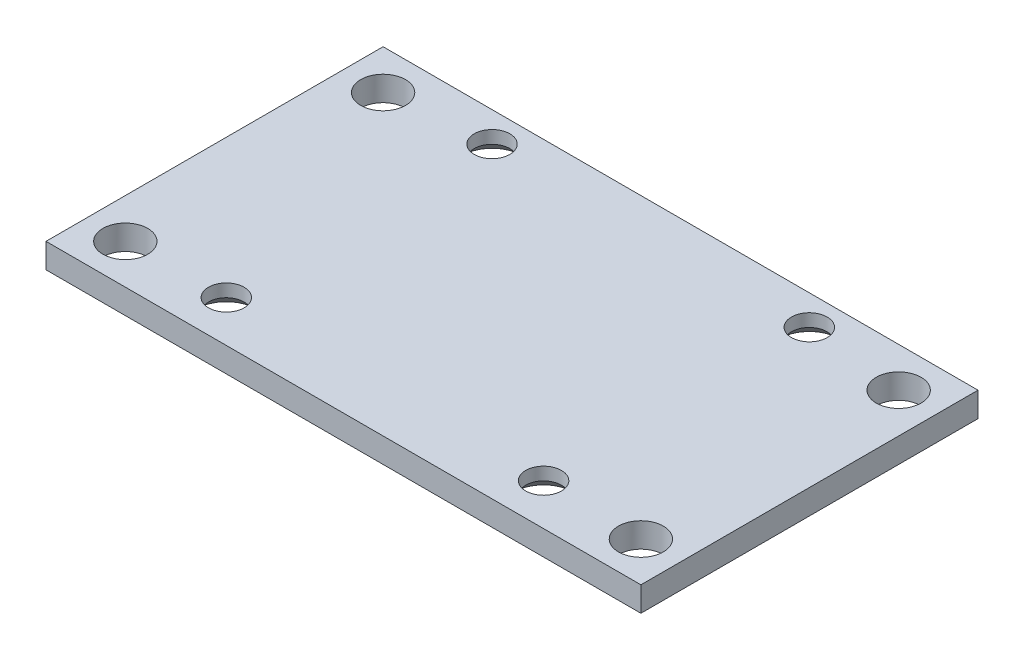
from build123d import *

# Parameters (mm, degrees)
SKETCH1_W                       = 30
SKETCH1_H                       = 17
BOSS_EXTRUDE1_DEPTH             = 1.2446
M1_6_CLEARANCE_HOLE1_AT_2_COUNT = 2
M1_6_CLEARANCE_HOLE1_AT_2_PITCH = 16
M1_6_CLEARANCE_HOLE1_AT_3_COUNT = 2
M1_6_CLEARANCE_HOLE1_AT_3_PITCH = 13.4
M1_6_CLEARANCE_HOLE1_AT_4_COUNT = 2
M1_6_CLEARANCE_HOLE1_AT_4_PITCH = 20.870074269
F_2_CLEARANCE_HOLE1_D           = 2.2606
F_2_CLEARANCE_HOLE1_DEPTH       = 2.032
F_2_CLEARANCE_HOLE1_TIP         = 0.679152758


with BuildPart() as part:
    # Sketch1 → Boss-Extrude1 (new body)
    with BuildSketch(Plane(origin=(0, 0, 0), x_dir=(1, 0, 0), z_dir=(0, 1, 0))):
        Rectangle(SKETCH1_W, SKETCH1_H)
    extrude(amount=BOSS_EXTRUDE1_DEPTH)

    # Sketch4 → M1.6 Clearance Hole1 (revolve, cut)
    with BuildSketch(Plane(origin=(-8, 0, 6.407104521), x_dir=(0, 0, -1), z_dir=(1, 0, 0))):
        Polygon((0, 0), (0, 1.2446), (0.9, 1.2446), (0.9, 0.6), (1.5, 0), align=None)
    m1_6_clearance_hole1 = revolve(axis=Axis((-8, -6.35, 6.407104521), (0, 1, 0)), mode=Mode.SUBTRACT)

    # M1.6 Clearance Hole1 at 2: M1.6 Clearance Hole1 ×2
    with Locations(*[(i * M1_6_CLEARANCE_HOLE1_AT_2_PITCH, 0, 0) for i in range(1, M1_6_CLEARANCE_HOLE1_AT_2_COUNT)]):
        add(m1_6_clearance_hole1, mode=Mode.SUBTRACT)

    # M1.6 Clearance Hole1 at 3: M1.6 Clearance Hole1 ×2
    with Locations(*[(0, 0, -i * M1_6_CLEARANCE_HOLE1_AT_3_PITCH) for i in range(1, M1_6_CLEARANCE_HOLE1_AT_3_COUNT)]):
        add(m1_6_clearance_hole1, mode=Mode.SUBTRACT)

    # M1.6 Clearance Hole1 at 4: M1.6 Clearance Hole1 ×2
    with Locations(*[Vector(0.766647966540687, 0, -0.6420676719778297) * (i * M1_6_CLEARANCE_HOLE1_AT_4_PITCH) for i in range(1, M1_6_CLEARANCE_HOLE1_AT_4_COUNT)]):
        add(m1_6_clearance_hole1, mode=Mode.SUBTRACT)

    # #2 Clearance Hole1
    with Locations(Plane(origin=(0, 1.2446, 0), x_dir=(-1, 0, 0), z_dir=(0, 1, 0))):
        with Locations((13, -6.5), (13, 6.5), (-13, -6.5), (-13, 6.5)):
            Hole(F_2_CLEARANCE_HOLE1_D / 2, depth=F_2_CLEARANCE_HOLE1_DEPTH)
            with Locations((0, 0, -(F_2_CLEARANCE_HOLE1_DEPTH + F_2_CLEARANCE_HOLE1_TIP / 2))):  # 118° drill point
                Cone(0, F_2_CLEARANCE_HOLE1_D / 2, F_2_CLEARANCE_HOLE1_TIP, mode=Mode.SUBTRACT)


solid = part.part
